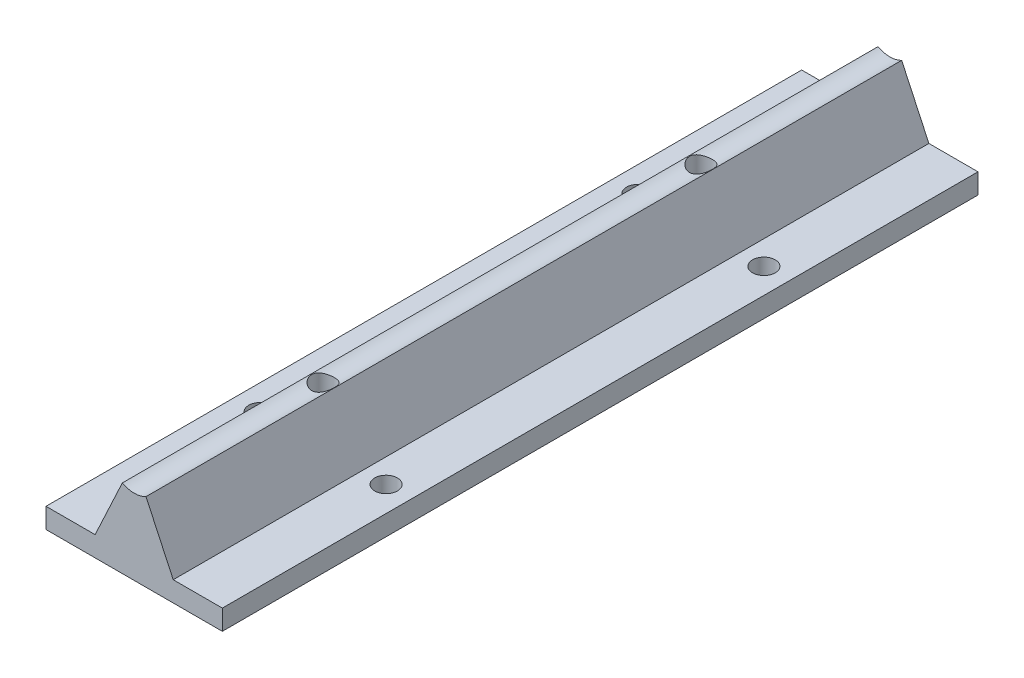
from build123d import *

# Parameters (mm, degrees)
EXTRUDE_1_DEPTH        = 150
SKETCH_3_R             = 2.25
CUT_EXTRUDE_1_DEPTH    = 20
PATTERN_LINEAR_1_COUNT = 2
PATTERN_LINEAR_1_PITCH = 75


with BuildPart() as part:
    # 草图2 → 凸台-拉伸1 (new body)
    with BuildSketch(Plane.XY):
        with BuildLine():
            Line((2.35, -4.413332075), (7.752951986, -16))
            Line((7.752951986, -16), (17.5, -16))
            Line((17.5, -16), (17.5, -20))
            Line((17.5, -20), (-17.5, -20))
            Line((-17.5, -20), (-17.5, -16))
            Line((-17.5, -16), (-7.752951986, -16))
            Line((-7.752951986, -16), (-2.35, -4.413332075))
            ThreePointArc((-2.35, -4.413332075), (0, -5), (2.35, -4.413332075))
        make_face()
    extrude(amount=-EXTRUDE_1_DEPTH)

    # 草图3 → 切除-拉伸1 (cut)
    with BuildSketch(Plane(origin=(0, 0, 0), x_dir=(1, 0, 0), z_dir=(0, 1, 0))):
        with Locations(Location((12.5, 37.5, 0), (0, 0, 270))):
            Circle(SKETCH_3_R)
        with Locations(Location((-12.5, 37.5, 0), (0, 0, 270))):
            Circle(SKETCH_3_R)
    cut_extrude_1 = extrude(amount=-CUT_EXTRUDE_1_DEPTH, mode=Mode.SUBTRACT)

    # 草图4 → 切除-旋转1 (revolve, cut)
    with BuildSketch(Plane.XY.offset(-37.5), mode=Mode.PRIVATE) as cut_revolve_1_sk:
        Polygon((-2.25, -4.465142775), (-2.25, -13.815142775), (-3.15, -13.815142775), (-3.15, -20), (0, -20), (0, -4.465142775), align=None)
    cut_revolve_1 = revolve(cut_revolve_1_sk.sketch.rotate(Axis((0, -20, -37.5), (0, 1, 0)), 180), axis=Axis((0, -20, -37.5), (0, 1, 0)), mode=Mode.SUBTRACT)

    # 阵列(线性)1: 切除-拉伸1, 切除-旋转1 ×2
    with Locations(*[(0, 0, -i * PATTERN_LINEAR_1_PITCH) for i in range(1, PATTERN_LINEAR_1_COUNT)]):
        add(cut_extrude_1, mode=Mode.SUBTRACT)
        add(cut_revolve_1, mode=Mode.SUBTRACT)


solid = part.part
